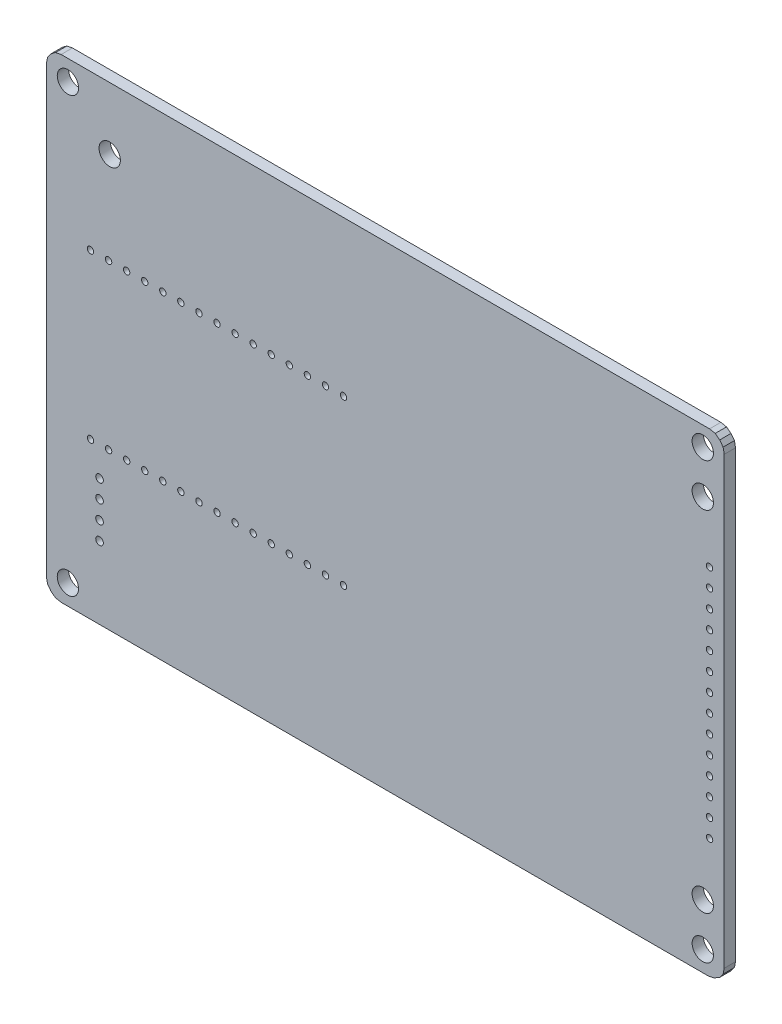
from build123d import *

# Parameters (mm, degrees)
SKIZZE1_R                       = 1.5
SKIZZE1_R_2                     = 0.45
SKIZZE1_R_3                     = 0.535
AUFSATZ_LINEAR_AUSTRAGEN1_DEPTH = 1.59


with BuildPart() as part:
    # Skizze1 → Aufsatz-Linear austragen1 (new body)
    with BuildSketch(Plane.XY):
        Polygon((57.308733333, 10.953733333), (57.4675, 11.7475), (57.943733333, 12.3825), (58.578766667, 12.858733333), (59.3725, 13.0175), (150.495, 13.0175), (151.288733333, 12.858733333), (151.923733333, 12.3825), (152.4, 11.7475), (152.558733333, 10.953733333), (152.558733333, -51.593733333), (152.4, -52.3875), (151.923733333, -53.0225), (151.13, -53.498733333), (150.336266667, -53.6575), (59.3725, -53.6575), (58.578766667, -53.498733333), (57.943733333, -53.0225), (57.4675, -52.3875), (57.308733333, -51.593733333), align=None)
        with Locations((60.325, 10.16)):
            Circle(SKIZZE1_R, mode=Mode.SUBTRACT)
        with Locations((66.198733333, 4.286266667)):
            Circle(SKIZZE1_R, mode=Mode.SUBTRACT)
        with Locations((91.44, -8.731233333)):
            Circle(SKIZZE1_R_2, mode=Mode.SUBTRACT)
        with Locations((88.9, -8.731233333)):
            Circle(SKIZZE1_R_2, mode=Mode.SUBTRACT)
        with Locations((86.36, -8.731233333)):
            Circle(SKIZZE1_R_2, mode=Mode.SUBTRACT)
        with Locations((83.82, -8.731233333)):
            Circle(SKIZZE1_R_2, mode=Mode.SUBTRACT)
        with Locations((81.28, -8.731233333)):
            Circle(SKIZZE1_R_2, mode=Mode.SUBTRACT)
        with Locations((78.74, -8.731233333)):
            Circle(SKIZZE1_R_2, mode=Mode.SUBTRACT)
        with Locations((76.2, -8.731233333)):
            Circle(SKIZZE1_R_2, mode=Mode.SUBTRACT)
        with Locations((73.66, -8.731233333)):
            Circle(SKIZZE1_R_2, mode=Mode.SUBTRACT)
        with Locations((71.12, -8.731233333)):
            Circle(SKIZZE1_R_2, mode=Mode.SUBTRACT)
        with Locations((68.58, -8.731233333)):
            Circle(SKIZZE1_R_2, mode=Mode.SUBTRACT)
        with Locations((66.04, -8.731233333)):
            Circle(SKIZZE1_R_2, mode=Mode.SUBTRACT)
        with Locations((63.5, -8.731233333)):
            Circle(SKIZZE1_R_2, mode=Mode.SUBTRACT)
        with Locations((99.06, -8.731233333)):
            Circle(SKIZZE1_R_2, mode=Mode.SUBTRACT)
        with Locations((96.52, -8.731233333)):
            Circle(SKIZZE1_R_2, mode=Mode.SUBTRACT)
        with Locations((93.98, -8.731233333)):
            Circle(SKIZZE1_R_2, mode=Mode.SUBTRACT)
        with Locations((78.74, -31.75)):
            Circle(SKIZZE1_R_2, mode=Mode.SUBTRACT)
        with Locations((81.28, -31.75)):
            Circle(SKIZZE1_R_2, mode=Mode.SUBTRACT)
        with Locations((83.82, -31.75)):
            Circle(SKIZZE1_R_2, mode=Mode.SUBTRACT)
        with Locations((86.36, -31.75)):
            Circle(SKIZZE1_R_2, mode=Mode.SUBTRACT)
        with Locations((88.9, -31.75)):
            Circle(SKIZZE1_R_2, mode=Mode.SUBTRACT)
        with Locations((91.44, -31.75)):
            Circle(SKIZZE1_R_2, mode=Mode.SUBTRACT)
        with Locations((93.98, -31.75)):
            Circle(SKIZZE1_R_2, mode=Mode.SUBTRACT)
        with Locations((96.52, -31.75)):
            Circle(SKIZZE1_R_2, mode=Mode.SUBTRACT)
        with Locations((99.06, -31.75)):
            Circle(SKIZZE1_R_2, mode=Mode.SUBTRACT)
        with Locations((64.77, -43.4975)):
            Circle(SKIZZE1_R_3, mode=Mode.SUBTRACT)
        with Locations((64.77, -40.9575)):
            Circle(SKIZZE1_R_3, mode=Mode.SUBTRACT)
        with Locations((64.77, -38.417466667)):
            Circle(SKIZZE1_R_3, mode=Mode.SUBTRACT)
        with Locations((64.77, -35.8775)):
            Circle(SKIZZE1_R_3, mode=Mode.SUBTRACT)
        with Locations((63.5, -31.75)):
            Circle(SKIZZE1_R_2, mode=Mode.SUBTRACT)
        with Locations((66.04, -31.75)):
            Circle(SKIZZE1_R_2, mode=Mode.SUBTRACT)
        with Locations((68.58, -31.75)):
            Circle(SKIZZE1_R_2, mode=Mode.SUBTRACT)
        with Locations((71.12, -31.75)):
            Circle(SKIZZE1_R_2, mode=Mode.SUBTRACT)
        with Locations((73.66, -31.75)):
            Circle(SKIZZE1_R_2, mode=Mode.SUBTRACT)
        with Locations((76.2, -31.75)):
            Circle(SKIZZE1_R_2, mode=Mode.SUBTRACT)
        with Locations((60.325, -50.8)):
            Circle(SKIZZE1_R, mode=Mode.SUBTRACT)
        with Locations((149.5425, -44.7675)):
            Circle(SKIZZE1_R, mode=Mode.SUBTRACT)
        with Locations((149.5425, -50.8)):
            Circle(SKIZZE1_R, mode=Mode.SUBTRACT)
        with Locations((150.495, -11.43)):
            Circle(SKIZZE1_R_2, mode=Mode.SUBTRACT)
        with Locations((150.495, -13.97)):
            Circle(SKIZZE1_R_2, mode=Mode.SUBTRACT)
        with Locations((150.495, -16.51)):
            Circle(SKIZZE1_R_2, mode=Mode.SUBTRACT)
        with Locations((150.495, -19.05)):
            Circle(SKIZZE1_R_2, mode=Mode.SUBTRACT)
        with Locations((150.495, -21.59)):
            Circle(SKIZZE1_R_2, mode=Mode.SUBTRACT)
        with Locations((150.495, -24.13)):
            Circle(SKIZZE1_R_2, mode=Mode.SUBTRACT)
        with Locations((150.495, -26.67)):
            Circle(SKIZZE1_R_2, mode=Mode.SUBTRACT)
        with Locations((150.495, -29.21)):
            Circle(SKIZZE1_R_2, mode=Mode.SUBTRACT)
        with Locations((150.495, -31.75)):
            Circle(SKIZZE1_R_2, mode=Mode.SUBTRACT)
        with Locations((150.495, -34.29)):
            Circle(SKIZZE1_R_2, mode=Mode.SUBTRACT)
        with Locations((150.495, -36.83)):
            Circle(SKIZZE1_R_2, mode=Mode.SUBTRACT)
        with Locations((149.5425, 10.318733333)):
            Circle(SKIZZE1_R, mode=Mode.SUBTRACT)
        with Locations((149.5425, 4.286266667)):
            Circle(SKIZZE1_R, mode=Mode.SUBTRACT)
        with Locations((150.495, -8.89)):
            Circle(SKIZZE1_R_2, mode=Mode.SUBTRACT)
        with Locations((150.495, -3.81)):
            Circle(SKIZZE1_R_2, mode=Mode.SUBTRACT)
        with Locations((150.495, -6.35)):
            Circle(SKIZZE1_R_2, mode=Mode.SUBTRACT)
    extrude(amount=AUFSATZ_LINEAR_AUSTRAGEN1_DEPTH)


solid = part.part
